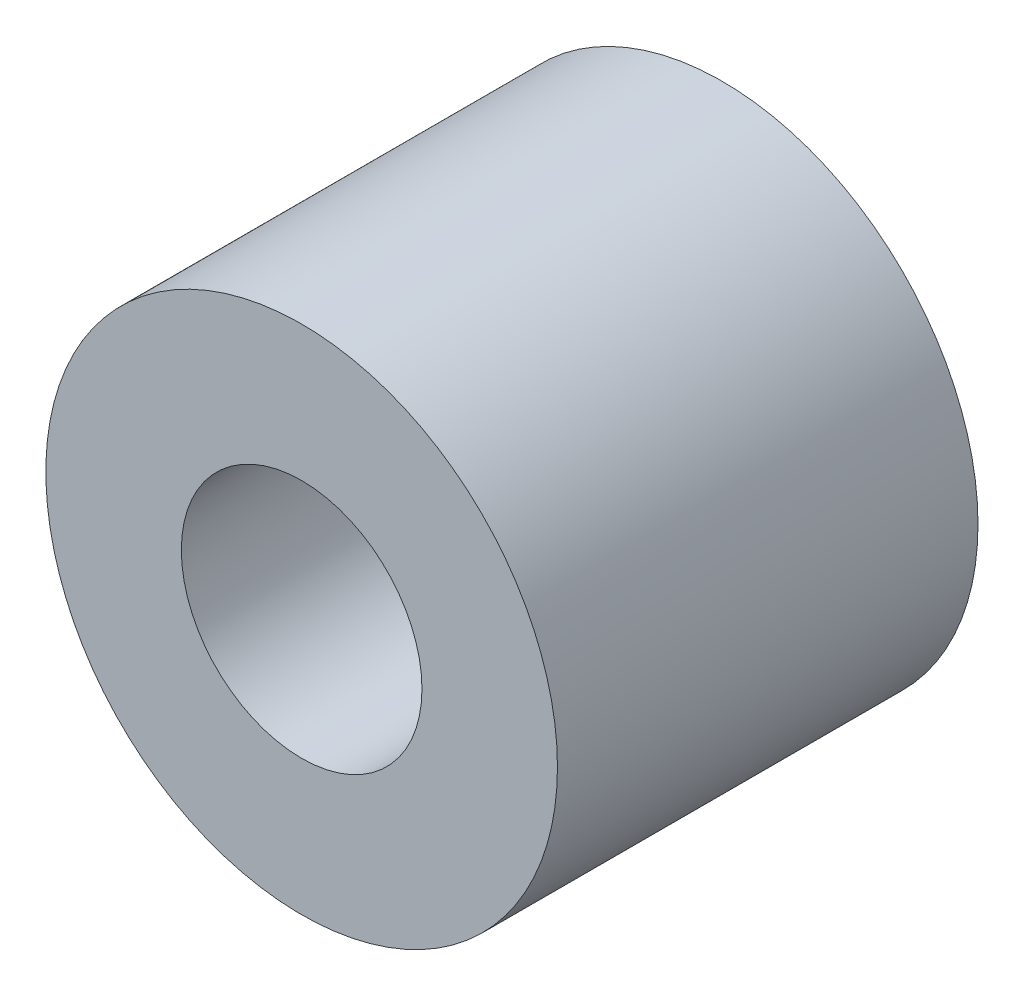
from build123d import *

# Parameters (mm, degrees)
SKETCH1_R           = 10.95
SKETCH1_R_2         = 5.15
BOSS_EXTRUDE1_DEPTH = 18


with BuildPart() as part:
    # Sketch1 → Boss-Extrude1 (new body)
    with BuildSketch(Plane.XY):
        Circle(SKETCH1_R)
        Circle(SKETCH1_R_2, mode=Mode.SUBTRACT)
    extrude(amount=BOSS_EXTRUDE1_DEPTH)


solid = part.part
